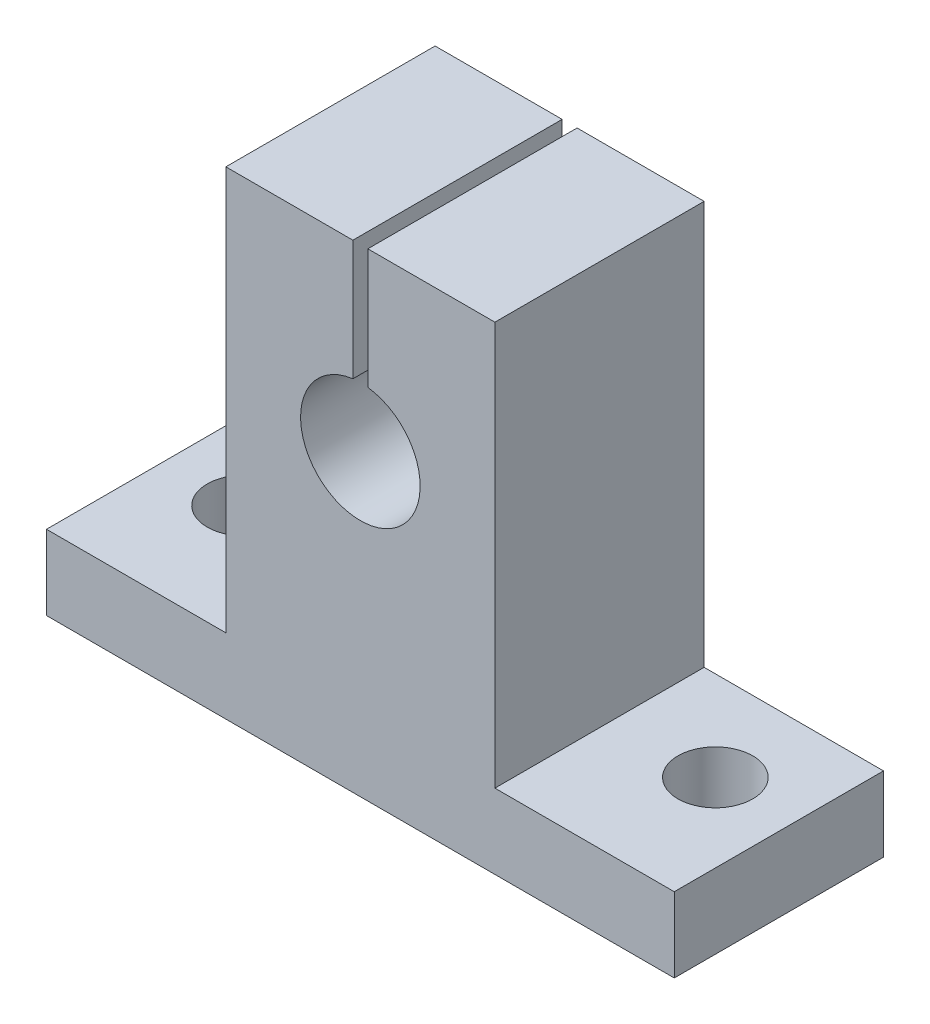
from build123d import *

# Parameters (mm, degrees)
ESQUISSE1_W             = 42
ESQUISSE1_H             = 14
BOSS_EXTRU_1_DEPTH      = 32
ESQUISSE2_W             = 12
ESQUISSE2_H             = 27
ENL_V_MAT_EXTRU_1_DEPTH = 41.755367745
ESQUISSE3_R             = 4
ENL_V_MAT_EXTRU_2_DEPTH = 41.755367745
ESQUISSE4_W             = 1
ESQUISSE4_H             = 13.961299029
ENL_V_MAT_EXTRU_3_DEPTH = 41.755367745
ESQUISSE5_R             = 2.5
ENL_V_MAT_EXTRU_4_DEPTH = 35.9141805


with BuildPart() as part:
    # Esquisse1 → Boss.-Extru.1 (new body)
    with BuildSketch(Plane(origin=(0, 0, 0), x_dir=(1, 0, 0), z_dir=(0, 1, 0))):
        Rectangle(ESQUISSE1_W, ESQUISSE1_H)
    extrude(amount=BOSS_EXTRU_1_DEPTH)

    # Esquisse2 → Enlèv. mat.-Extru.1 (cut, through all)
    with BuildSketch(Plane.XY.offset(7)):
        with Locations((-15, 18.5)):
            Rectangle(ESQUISSE2_W, ESQUISSE2_H)
        with Locations((15, 18.5)):
            Rectangle(ESQUISSE2_W, ESQUISSE2_H)
    extrude(amount=-ENL_V_MAT_EXTRU_1_DEPTH, mode=Mode.SUBTRACT)

    # Esquisse3 → Enlèv. mat.-Extru.2 (cut, through all)
    with BuildSketch(Plane.XY.offset(7)):
        with Locations((0, 20)):
            Circle(ESQUISSE3_R)
    extrude(amount=-ENL_V_MAT_EXTRU_2_DEPTH, mode=Mode.SUBTRACT)

    # Esquisse4 → Enlèv. mat.-Extru.3 (cut, through all)
    with BuildSketch(Plane.XY.offset(7)):
        with Locations((0, 25.019350485)):
            Rectangle(ESQUISSE4_W, ESQUISSE4_H)
    extrude(amount=-ENL_V_MAT_EXTRU_3_DEPTH, mode=Mode.SUBTRACT)

    # Esquisse5 → Enlèv. mat.-Extru.4 (cut, through all)
    with BuildSketch(Plane(origin=(0, 5, 0), x_dir=(1, 0, 0), z_dir=(0, 1, 0))):
        with Locations(Location((-15.75, 1, 0), (0, 0, 270))):
            Circle(ESQUISSE5_R)
        with Locations(Location((15.75, 1, 0), (0, 0, 270))):
            Circle(ESQUISSE5_R)
    extrude(amount=-ENL_V_MAT_EXTRU_4_DEPTH, mode=Mode.SUBTRACT)


solid = part.part
